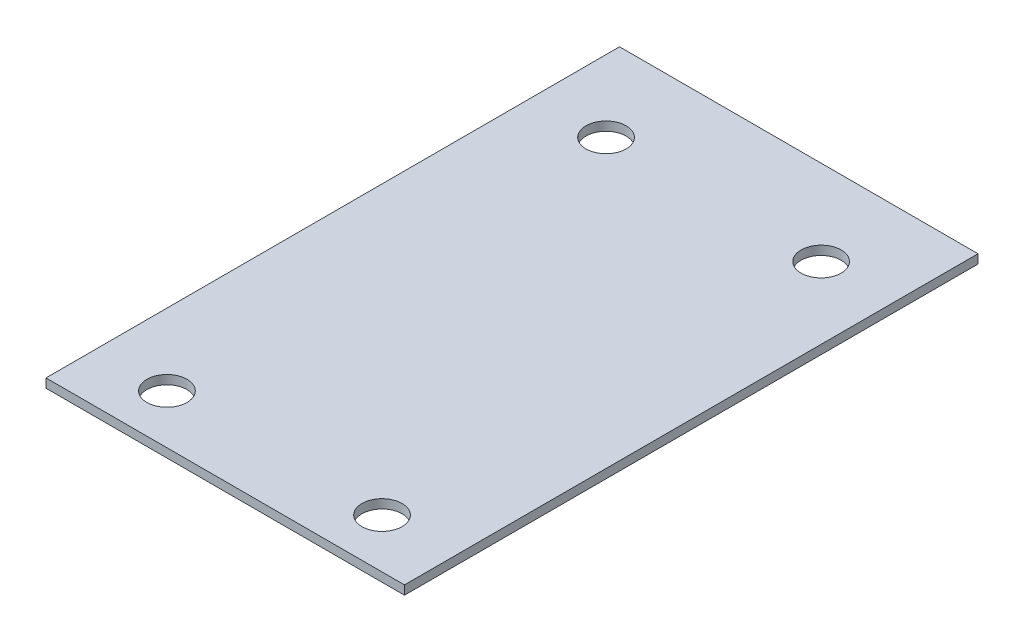
from build123d import *

# Parameters (mm, degrees)
SKETCH1_W           = 127
SKETCH1_H           = 203.2
SKETCH1_R           = 7.112
BOSS_EXTRUDE2_DEPTH = 3.175


with BuildPart() as part:
    # Sketch1 → Boss-Extrude2 (new body)
    with BuildSketch(Plane(origin=(0, 0, 0), x_dir=(1, 0, 0), z_dir=(0, 1, 0))):
        with Locations((63.5, 101.6)):
            Rectangle(SKETCH1_W, SKETCH1_H)
        with Locations(Location((25.4, 173.0248, 0), (0, 0, 270))):
            Circle(SKETCH1_R, mode=Mode.SUBTRACT)
        with Locations(Location((25.4, 17.4498, 0), (0, 0, 270))):
            Circle(SKETCH1_R, mode=Mode.SUBTRACT)
        with Locations(Location((101.6, 17.4498, 0), (0, 0, 90))):
            Circle(SKETCH1_R, mode=Mode.SUBTRACT)
        with Locations(Location((101.6, 173.0248, 0), (0, 0, 90))):
            Circle(SKETCH1_R, mode=Mode.SUBTRACT)
    extrude(amount=BOSS_EXTRUDE2_DEPTH)


solid = part.part
